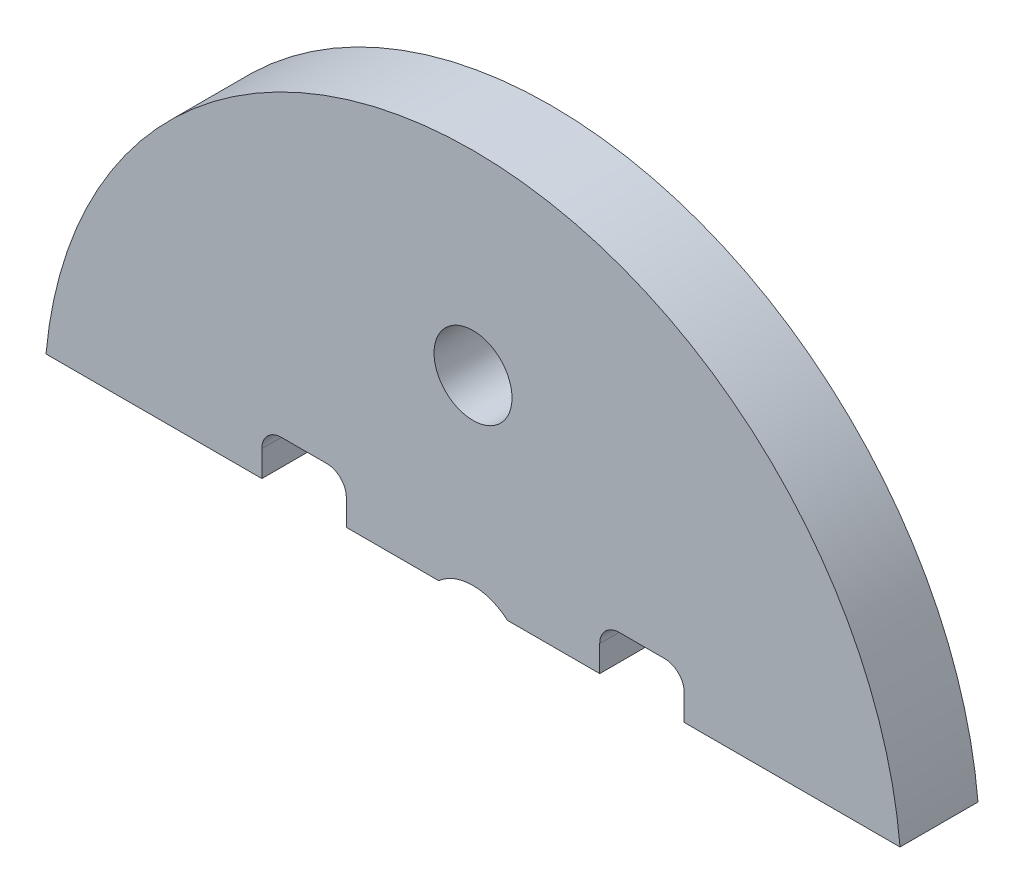
from build123d import *

# Parameters (mm, degrees)
MODEL_R                 = 1.5
SALIENTE_EXTRUIR1_DEPTH = 3


with BuildPart() as part:
    # Model → Saliente-Extruir1 (new body)
    with BuildSketch(Plane.XY):
        with BuildLine():
            Line((223.122807913, 245.202019993), (221.372807913, 245.202019993))
            ThreePointArc((221.372807913, 245.202019993), (220.842477828, 244.982350079), (220.622807913, 244.452019993))
            Line((220.622807913, 244.452019993), (220.622807913, 243.452019993))
            Line((220.622807913, 243.452019993), (217.070683569, 243.452019993))
            ThreePointArc((217.070683569, 243.452019993), (215.747807914, 243.952019993), (214.424932258, 243.452019993))
            Line((214.424932258, 243.452019993), (210.872807913, 243.452019993))
            Line((210.872807913, 243.452019993), (210.872807913, 244.452019993))
            ThreePointArc((210.872807913, 244.452019993), (210.653137999, 244.982350079), (210.122807913, 245.202019993))
            Line((210.122807913, 245.202019993), (208.372807913, 245.202019993))
            ThreePointArc((208.372807913, 245.202019993), (207.842477828, 244.982350079), (207.622807913, 244.452019993))
            Line((207.622807913, 244.452019993), (207.622807913, 243.452019993))
            Line((207.622807913, 243.452019993), (199.316131188, 243.452019993))
            ThreePointArc((199.316131188, 243.452019993), (215.747807914, 258.452019993), (232.179484639, 243.452019993))
            Line((232.179484639, 243.452019993), (223.872807913, 243.452019993))
            Line((223.872807913, 243.452019993), (223.872807913, 244.452019993))
            ThreePointArc((223.872807913, 244.452019993), (223.653137999, 244.982350079), (223.122807913, 245.202019993))
        make_face()
        with Locations((215.747807914, 250.952019993)):
            Circle(MODEL_R, mode=Mode.SUBTRACT)
    extrude(amount=SALIENTE_EXTRUIR1_DEPTH)


solid = part.part
